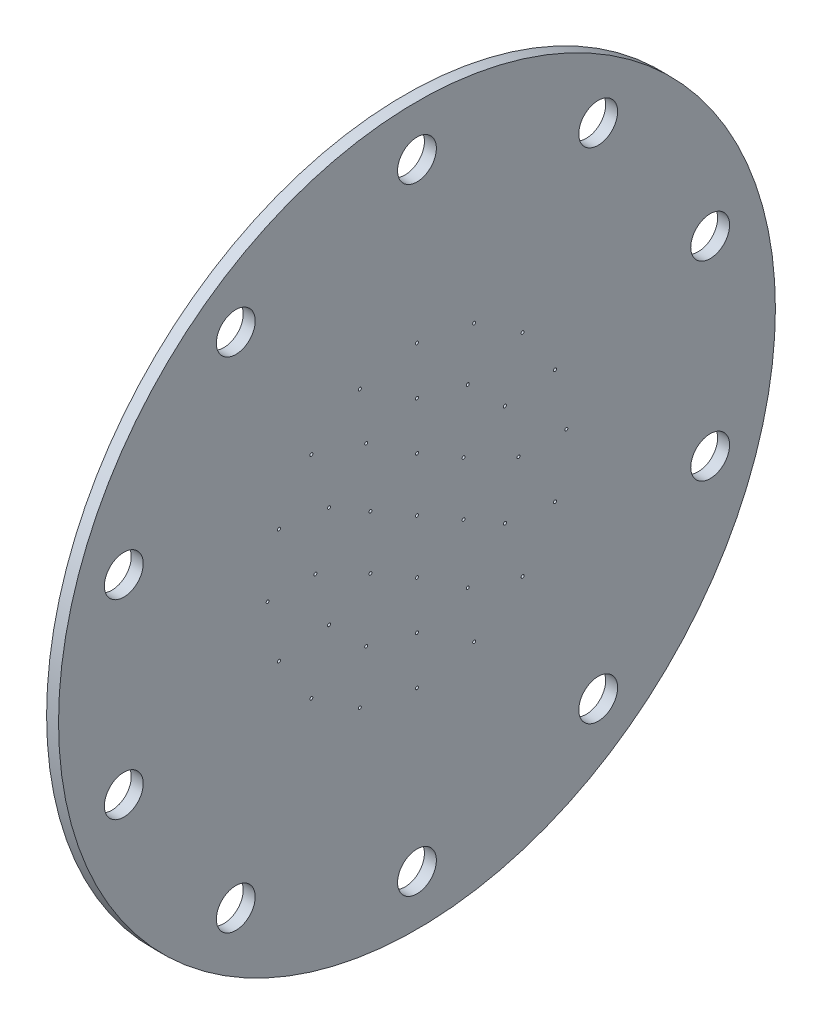
from build123d import *

# Parameters (mm, degrees)
SKETCH3_R          = 0.25
CUT_EXTRUDE1_DEPTH = 85.876380696
SKETCH4_R          = 3.25
CUT_EXTRUDE2_DEPTH = 10


with BuildPart() as part:
    # Sketch2 → Revolve1 (revolve)
    with BuildSketch(Plane.XY, mode=Mode.PRIVATE) as revolve1_sk:
        Polygon((2, 0), (2, 31), (2, 60), (0, 60), (0, 0), align=None)
    revolve(revolve1_sk.sketch.rotate(Axis((0, 0, 0), (1, 0, 0)), 90), axis=Axis((0, 0, 0), (1, 0, 0)))

    # Sketch3 → Cut-Extrude1 (cut, through all)
    with BuildSketch(Plane.ZY):
        Circle(SKETCH3_R)
        with Locations((0, 9)):
            Circle(SKETCH3_R)
        with Locations((0, 17)):
            Circle(SKETCH3_R)
        with Locations((0, 25)):
            Circle(SKETCH3_R)
        with Locations((7.794228634, 4.5)):
            Circle(SKETCH3_R)
        with Locations((7.794228634, -4.5)):
            Circle(SKETCH3_R)
        with Locations((0, -9)):
            Circle(SKETCH3_R)
        with Locations((-7.794228634, -4.5)):
            Circle(SKETCH3_R)
        with Locations((-7.794228634, 4.5)):
            Circle(SKETCH3_R)
        with Locations((8.5, 14.722431864)):
            Circle(SKETCH3_R)
        with Locations((14.722431864, 8.5)):
            Circle(SKETCH3_R)
        with Locations((17, 0)):
            Circle(SKETCH3_R)
        with Locations((14.722431864, -8.5)):
            Circle(SKETCH3_R)
        with Locations((8.5, -14.722431864)):
            Circle(SKETCH3_R)
        with Locations((0, -17)):
            Circle(SKETCH3_R)
        with Locations((-8.5, -14.722431864)):
            Circle(SKETCH3_R)
        with Locations((-14.722431864, -8.5)):
            Circle(SKETCH3_R)
        with Locations((-17, 0)):
            Circle(SKETCH3_R)
        with Locations((-14.722431864, 8.5)):
            Circle(SKETCH3_R)
        with Locations((-8.5, 14.722431864)):
            Circle(SKETCH3_R)
        with Locations((9.567085809, 23.096988313)):
            Circle(SKETCH3_R)
        with Locations((17.67766953, 17.67766953)):
            Circle(SKETCH3_R)
        with Locations((23.096988313, 9.567085809)):
            Circle(SKETCH3_R)
        with Locations((25, 0)):
            Circle(SKETCH3_R)
        with Locations((23.096988313, -9.567085809)):
            Circle(SKETCH3_R)
        with Locations((17.67766953, -17.67766953)):
            Circle(SKETCH3_R)
        with Locations((9.567085809, -23.096988313)):
            Circle(SKETCH3_R)
        with Locations((0, -25)):
            Circle(SKETCH3_R)
        with Locations((-9.567085809, -23.096988313)):
            Circle(SKETCH3_R)
        with Locations((-17.67766953, -17.67766953)):
            Circle(SKETCH3_R)
        with Locations((-23.096988313, -9.567085809)):
            Circle(SKETCH3_R)
        with Locations((-25, 0)):
            Circle(SKETCH3_R)
        with Locations((-23.096988313, 9.567085809)):
            Circle(SKETCH3_R)
        with Locations((-17.67766953, 17.67766953)):
            Circle(SKETCH3_R)
        with Locations((-9.567085809, 23.096988313)):
            Circle(SKETCH3_R)
    extrude(amount=-CUT_EXTRUDE1_DEPTH, mode=Mode.SUBTRACT)

    # Sketch4 → Cut-Extrude2 (cut)
    with BuildSketch(Plane.ZY):
        with Locations((0, 51.6)):
            Circle(SKETCH4_R)
        with Locations((30.329719018, 41.74527691)):
            Circle(SKETCH4_R)
        with Locations((49.074516241, 15.94527691)):
            Circle(SKETCH4_R)
        with Locations((49.074516241, -15.94527691)):
            Circle(SKETCH4_R)
        with Locations((30.329719018, -41.74527691)):
            Circle(SKETCH4_R)
        with Locations((0, -51.6)):
            Circle(SKETCH4_R)
        with Locations((-30.329719018, -41.74527691)):
            Circle(SKETCH4_R)
        with Locations((-49.074516241, -15.94527691)):
            Circle(SKETCH4_R)
        with Locations((-49.074516241, 15.94527691)):
            Circle(SKETCH4_R)
        with Locations((-30.329719018, 41.74527691)):
            Circle(SKETCH4_R)
    extrude(amount=-CUT_EXTRUDE2_DEPTH, mode=Mode.SUBTRACT)


solid = part.part
